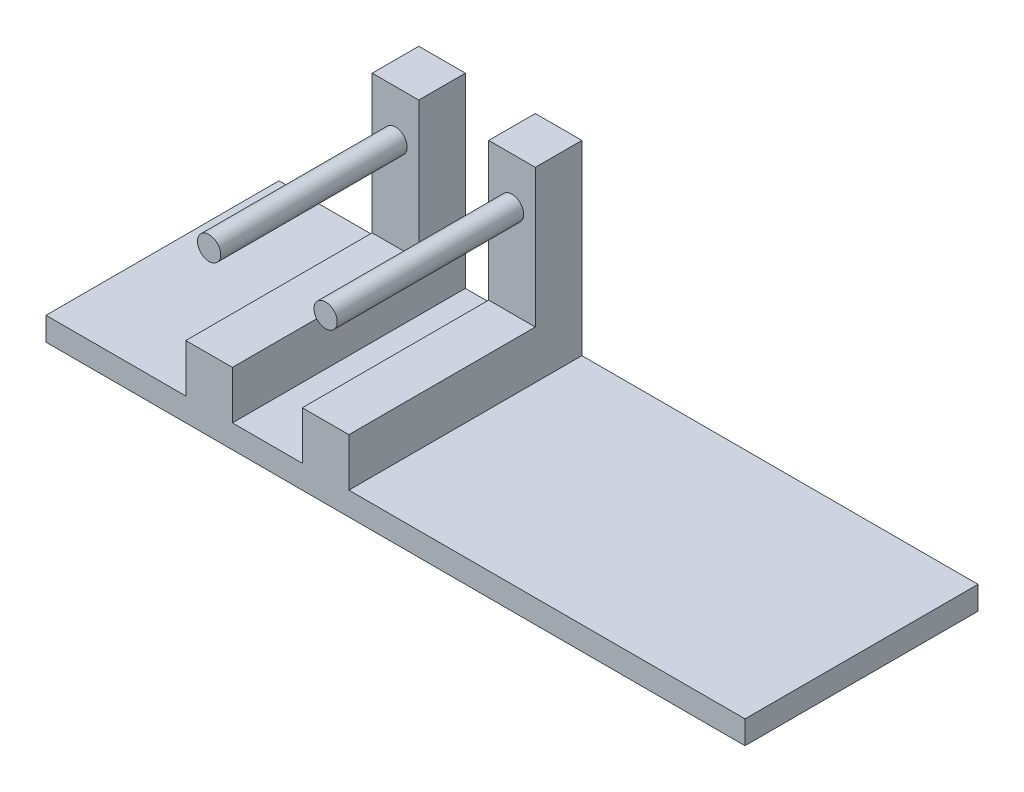
from build123d import *

# Parameters (mm, degrees)
BOSS_EXTRUDE1_DEPTH = 50
SKETCH2_W           = 35
SKETCH2_H           = 29.682212161
SKETCH2_R           = 2.5
CUT_EXTRUDE1_DEPTH  = 40


with BuildPart() as part:
    # Sketch1 → Boss-Extrude1 (new body)
    with BuildSketch(Plane.XY):
        Polygon((0, 5), (30, 5), (30, 45), (40, 45), (40, 5), (55, 5), (55, 45), (65, 45), (65, 5), (150, 5), (150, 0), (0, 0), align=None)
    extrude(amount=BOSS_EXTRUDE1_DEPTH)

    # Sketch2 → Cut-Extrude1 (cut)
    with BuildSketch(Plane.XY.offset(50)):
        with Locations((47.5, 30.15889392)):
            Rectangle(SKETCH2_W, SKETCH2_H)
        with Locations((35, 35)):
            Circle(SKETCH2_R, mode=Mode.SUBTRACT)
        with Locations((60, 35)):
            Circle(SKETCH2_R, mode=Mode.SUBTRACT)
    extrude(amount=-CUT_EXTRUDE1_DEPTH, mode=Mode.SUBTRACT)


solid = part.part
